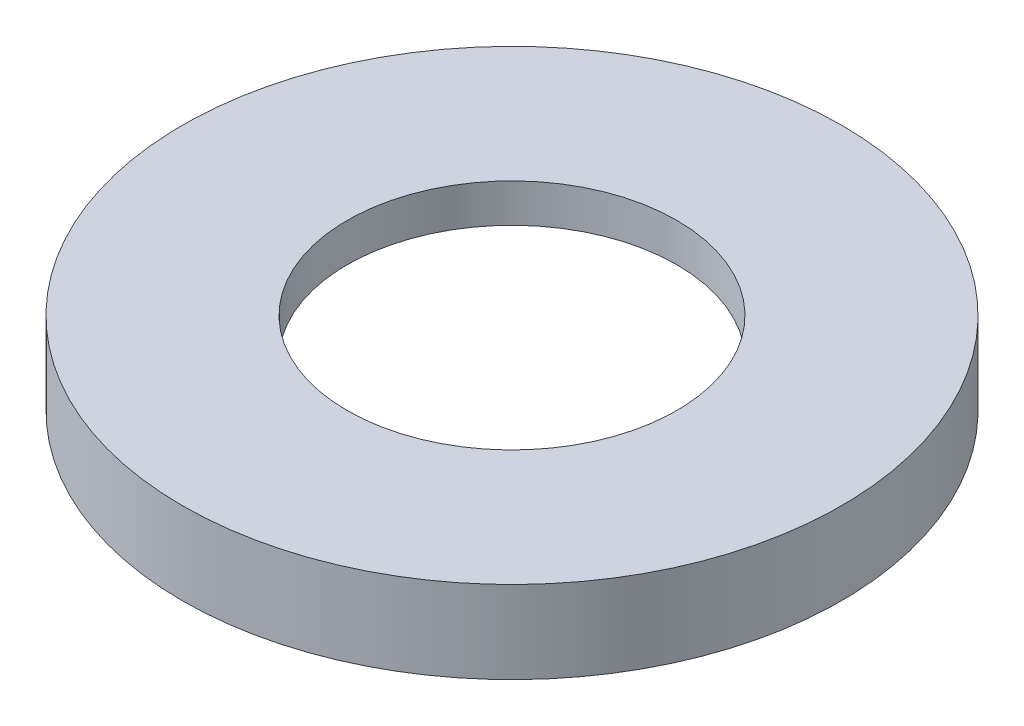
from build123d import *


with BuildPart() as part:
    # Sketch1 → Revolve1 (revolve)
    with BuildSketch(Plane(origin=(0, 0, 0), x_dir=(0, 0, -1), z_dir=(1, 0, 0)), mode=Mode.PRIVATE) as revolve1_sk:
        Polygon((-11.25, -2.938596491), (-11.25, -4.938596491), (-15, -4.938596491), (-15, -1.188596491), (-7.5, -1.188596491), (-7.5, -2.938596491), align=None)
    revolve(revolve1_sk.sketch.rotate(Axis((0, -462.696595862, 0), (0, 1, 0)), 180), axis=Axis((0, -462.696595862, 0), (0, 1, 0)))


solid = part.part
